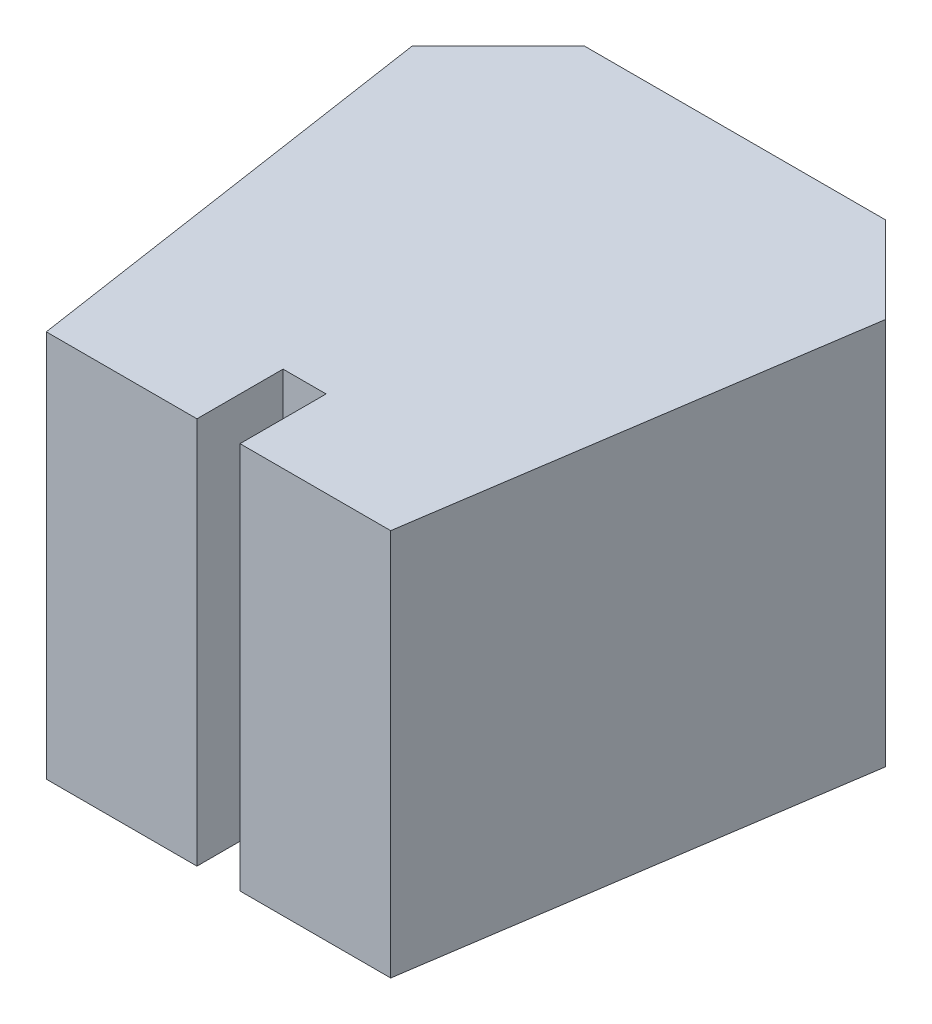
from build123d import *

# Parameters (mm, degrees)
BOSS_EXTRUDE1_START = -19300
BOSS_EXTRUDE1_DEPTH = 450


with BuildPart() as part:
    # Sketch1 → Boss-Extrude1 (new body)
    with BuildSketch(Plane(origin=(0, 0, 0), x_dir=(1, 0, 0), z_dir=(0, 1, 0)).offset(BOSS_EXTRUDE1_START)):
        Polygon((175, 300), (-175, 300), (-275, 200), (-200, -300), (-25, -300), (-25, -200), (25, -200), (25, -300), (200, -300), (275, 200), align=None)
    extrude(amount=BOSS_EXTRUDE1_DEPTH)


solid = part.part
